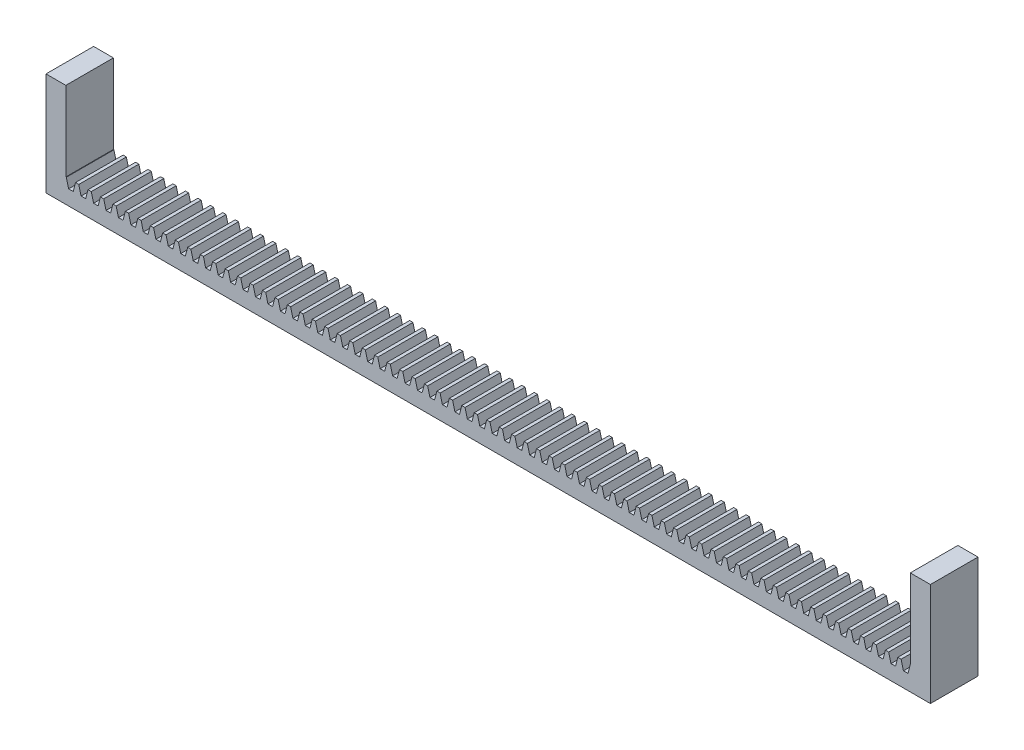
from build123d import *

# Parameters (mm, degrees)
BLANKSKE_W          = 223
BLANKSKE_H          = 6
BLANK_DEPTH         = 12
TOOTHCUTSIM_DEPTH   = 224.403222895
TEETHCUTS_COUNT     = 71
TEETHCUTS_PITCH     = 3.14159265
SKETCH1_W           = 5
SKETCH1_H           = 12
SKETCH1_W_2         = 5.072091403
BOSS_EXTRUDE1_DEPTH = 26


with BuildPart() as part:
    # BlankSke → Blank (new body)
    with BuildSketch(Plane.XY):
        with Locations((111.5, 3)):
            Rectangle(BLANKSKE_W, BLANKSKE_H)
    extrude(amount=-BLANK_DEPTH)

    # TooCutSkeSim → ToothCutSim (cut, through all)
    with BuildSketch(Plane.XY):
        Polygon((0.576126182, 3.75), (-0.576126182, 3.75), (-1.164584633, 6.0254), (1.164584633, 6.0254), align=None)
    toothcutsim = extrude(amount=-TOOTHCUTSIM_DEPTH, mode=Mode.SUBTRACT)

    # TeethCuts: ToothCutSim ×71
    with Locations(*[(i * TEETHCUTS_PITCH, 0, 0) for i in range(1, TEETHCUTS_COUNT)]):
        add(toothcutsim, mode=Mode.SUBTRACT)

    # Sketch1 → Boss-Extrude1 (add)
    with BuildSketch(Plane.XZ):
        with Locations((2.5, -6)):
            Rectangle(SKETCH1_W, SKETCH1_H)
        with Locations((220.463954299, -6)):
            Rectangle(SKETCH1_W_2, SKETCH1_H)
    extrude(amount=-BOSS_EXTRUDE1_DEPTH)


solid = part.part
